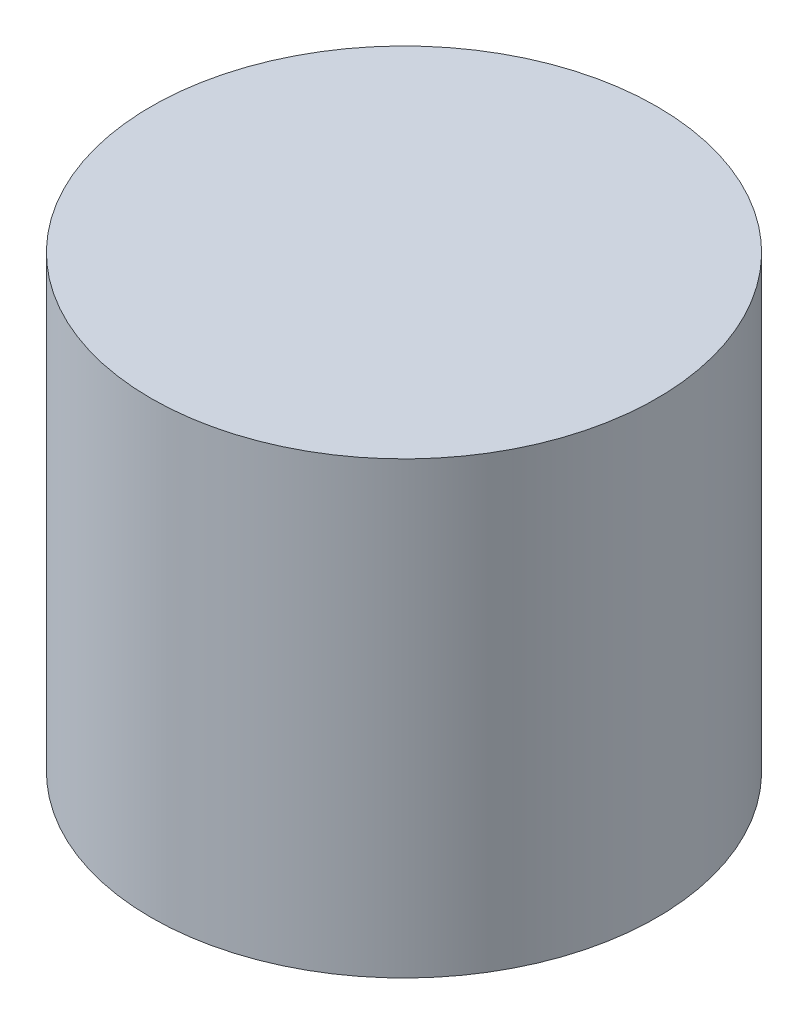
from build123d import *

# Parameters (mm, degrees)
SKETCH1_R           = 22.5
BOSS_EXTRUDE1_DEPTH = 40


with BuildPart() as part:
    # Sketch1 → Boss-Extrude1 (new body)
    with BuildSketch(Plane(origin=(0, 0, 0), x_dir=(1, 0, 0), z_dir=(0, 1, 0))):
        with Locations(Location((0, 0, 0), (0, 0, 270))):
            Circle(SKETCH1_R)
    extrude(amount=BOSS_EXTRUDE1_DEPTH)


solid = part.part
